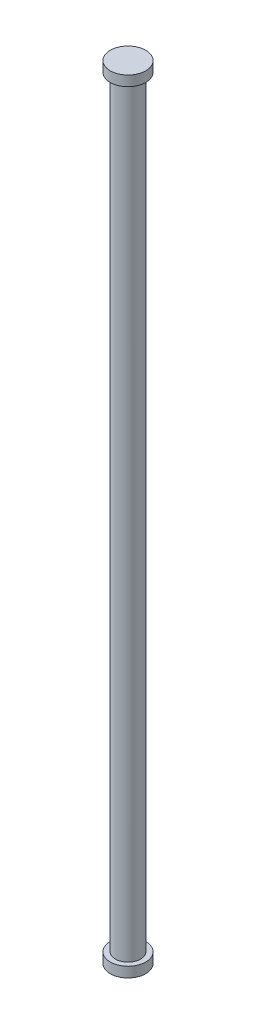
from build123d import *

# Parameters (mm, degrees)
SKETCH1_R           = 2.5
BOSS_EXTRUDE1_DEPTH = 154
SKETCH2_R           = 3.5
BOSS_EXTRUDE2_DEPTH = 2
BOSS_EXTRUDE3_START = -2
SKETCH3_R           = 3.5
BOSS_EXTRUDE3_DEPTH = 2


with BuildPart() as part:
    # Sketch1 → Boss-Extrude1 (new body)
    with BuildSketch(Plane(origin=(0, 0, 0), x_dir=(1, 0, 0), z_dir=(0, 1, 0))):
        with Locations(Location((0, 0, 0), (0, 0, 270))):
            Circle(SKETCH1_R)
    extrude(amount=BOSS_EXTRUDE1_DEPTH)

    # Sketch2 → Boss-Extrude2 (add)
    with BuildSketch(Plane.XZ):
        with Locations(Location((0, 0, 0), (0, 0, 270))):
            Circle(SKETCH2_R)
    extrude(amount=-BOSS_EXTRUDE2_DEPTH)

    # Sketch3 → Boss-Extrude3 (add)
    with BuildSketch(Plane(origin=(0, 154, 0), x_dir=(1, 0, 0), z_dir=(0, 1, 0)).offset(BOSS_EXTRUDE3_START)):
        with Locations(Location((0, 0, 0), (0, 0, 90))):
            Circle(SKETCH3_R)
    extrude(amount=BOSS_EXTRUDE3_DEPTH)


solid = part.part
